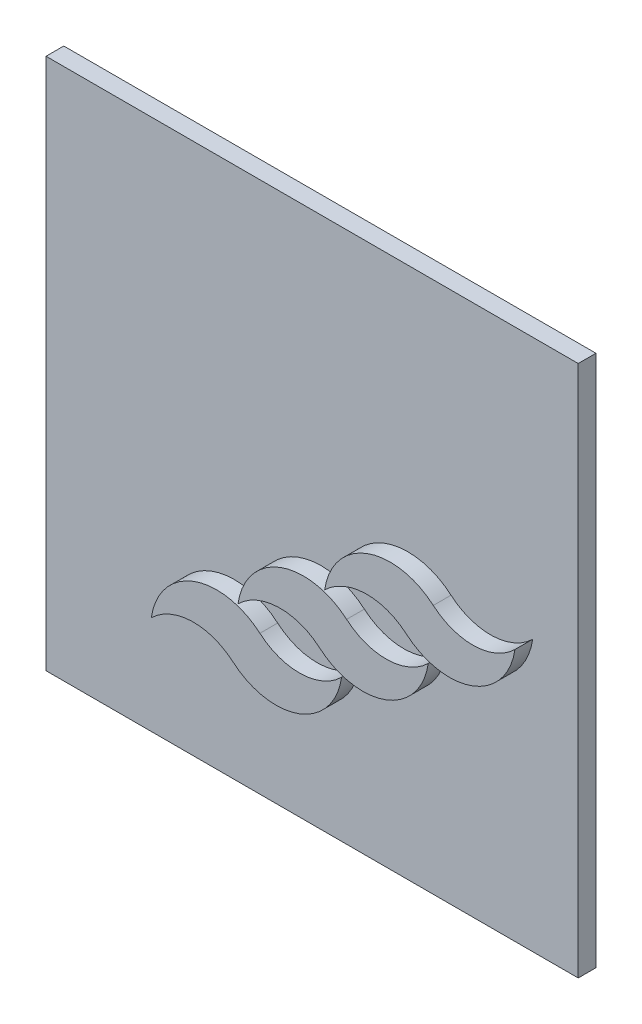
from build123d import *

# Parameters (mm, degrees)
SKICA1_W                = 300
SKICA1_H                = 300
P_IDAT_VYSUNUT_M1_DEPTH = 10
P_IDAT_VYSUNUT_M3_DEPTH = 10


with BuildPart() as part:
    # Skica1 → Přidat vysunutím1 (new body)
    with BuildSketch(Plane.XY):
        with Locations((150, 150)):
            Rectangle(SKICA1_W, SKICA1_H)
    extrude(amount=P_IDAT_VYSUNUT_M1_DEPTH)

    # Skica3 → Přidat vysunutím3 (add)
    with BuildSketch(Plane.XY.offset(10)):
        with BuildLine():
            ThreePointArc((115.351436594, 67.036617417), (152.787337691, 60.386270146), (176.568555926, 90.053212507))
            ThreePointArc((176.568555926, 90.053212507), (153.853792867, 80.346404756), (130.562326016, 88.573807107))
            ThreePointArc((130.562326016, 88.573807107), (93.126424919, 95.224154378), (69.345206683, 65.557212017))
            ThreePointArc((69.345206683, 65.557212017), (92.059969742, 75.264019769), (115.351436594, 67.036617417))
        make_face()
        with BuildLine():
            ThreePointArc((179.434133768, 119.807545389), (141.998232671, 126.45789266), (118.217014435, 96.790950299))
            ThreePointArc((118.217014435, 96.790950299), (140.931777494, 106.49775805), (164.223244346, 98.270355699))
            ThreePointArc((164.223244346, 98.270355699), (201.659145443, 91.620008428), (225.440363678, 121.286950789))
            ThreePointArc((225.440363678, 121.286950789), (202.725600619, 111.580143037), (179.434133768, 119.807545389))
        make_face()
        with BuildLine():
            ThreePointArc((228.30594152, 151.04128367), (190.870040423, 157.691630941), (167.088822187, 128.024688581))
            ThreePointArc((167.088822187, 128.024688581), (189.803585246, 137.731496332), (213.095052098, 129.504093981))
            ThreePointArc((213.095052098, 129.504093981), (250.530953195, 122.85374671), (274.31217143, 152.52068907))
            ThreePointArc((274.31217143, 152.52068907), (251.597408371, 142.813881319), (228.30594152, 151.04128367))
        make_face()
    extrude(amount=P_IDAT_VYSUNUT_M3_DEPTH)


solid = part.part
